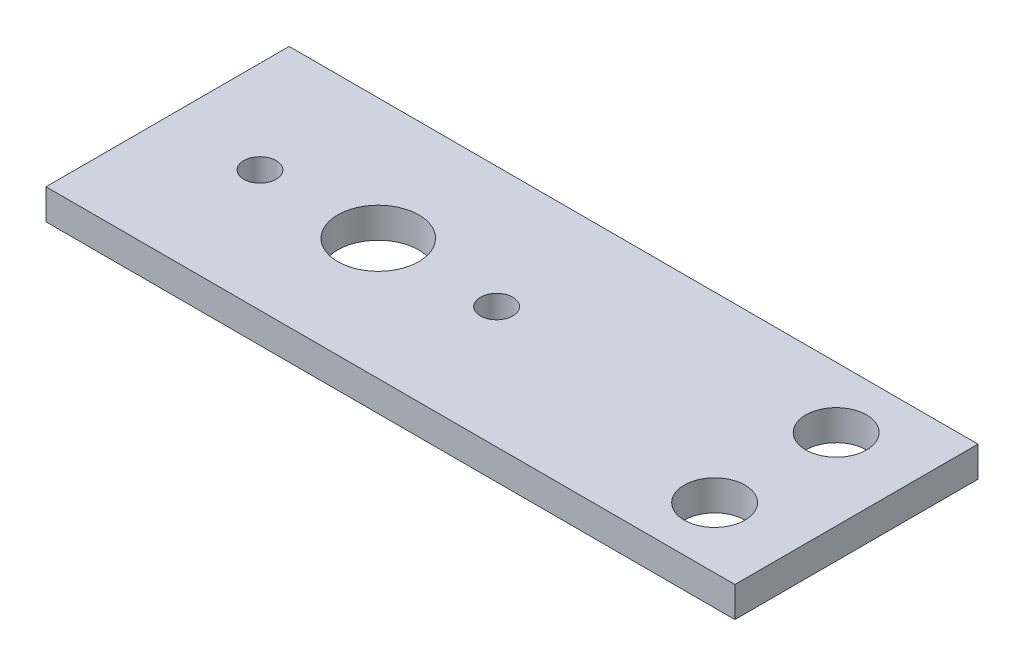
from build123d import *

# Parameters (mm, degrees)
SKETCH2_W           = 107.95
SKETCH2_H           = 38.1
SKETCH2_R           = 4.7625
BOSS_EXTRUDE1_DEPTH = 4.7625
SKETCH3_R           = 2.54
SKETCH3_R_2         = 6.35
CUT_EXTRUDE1_DEPTH  = 58.435916736


with BuildPart() as part:
    # Sketch2 → Boss-Extrude1 (new body)
    with BuildSketch(Plane(origin=(0, 0, 0), x_dir=(1, 0, 0), z_dir=(0, 1, 0))):
        Rectangle(SKETCH2_W, SKETCH2_H)
        with Locations(Location((41.275, 9.525, 0), (0, 0, 90))):
            Circle(SKETCH2_R, mode=Mode.SUBTRACT)
        with Locations(Location((41.275, -9.525, 0), (0, 0, 90))):
            Circle(SKETCH2_R, mode=Mode.SUBTRACT)
    extrude(amount=BOSS_EXTRUDE1_DEPTH)

    # Sketch3 → Cut-Extrude1 (cut, through all)
    with BuildSketch(Plane(origin=(0, 4.7625, 0), x_dir=(1, 0, 0), z_dir=(0, 1, 0))):
        with Locations(Location((-39.497, 0, 0), (0, 0, 270))):
            Circle(SKETCH3_R)
        with Locations(Location((-2.413, 0, 0), (0, 0, 270))):
            Circle(SKETCH3_R)
        with Locations(Location((-20.955, 0, 0), (0, 0, 270))):
            Circle(SKETCH3_R_2)
    extrude(amount=-CUT_EXTRUDE1_DEPTH, mode=Mode.SUBTRACT)


solid = part.part
